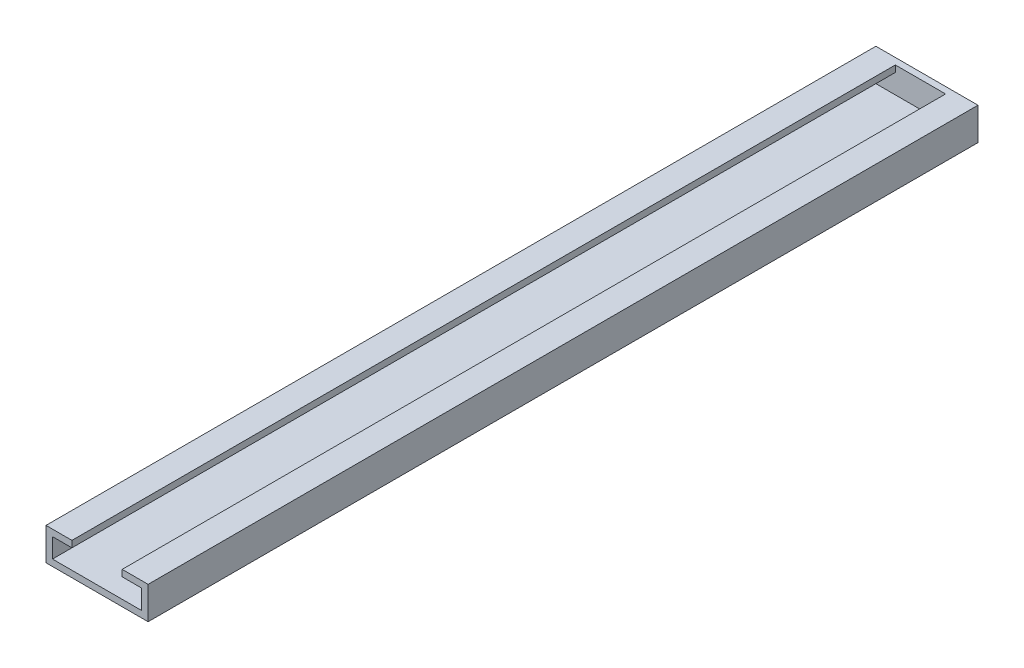
from build123d import *

# Parameters (mm, degrees)
BOSS_EXTRUDE1_DEPTH = 101.6
SKETCH2_W           = 0.8
SKETCH2_H           = 4
BOSS_EXTRUDE2_DEPTH = 12.6


with BuildPart() as part:
    # Sketch1 → Boss-Extrude1 (new body)
    with BuildSketch(Plane.XY):
        Polygon((3.1, 1.407251622), (3.1, 0.607251622), (5.5, 0.607251622), (5.5, -1.792748378), (-5.5, -1.792748378), (-5.5, 0.607251622), (-3.1, 0.607251622), (-3.1, 1.407251622), (-6.3, 1.407251622), (-6.3, -2.592748378), (6.3, -2.592748378), (6.3, 1.407251622), align=None)
    extrude(amount=BOSS_EXTRUDE1_DEPTH)

    # Sketch2 → Boss-Extrude2 (add)
    with BuildSketch(Plane.ZY.offset(6.3)):
        with Locations((-0.4, -0.592748378)):
            Rectangle(SKETCH2_W, SKETCH2_H)
    extrude(amount=-BOSS_EXTRUDE2_DEPTH)


solid = part.part
